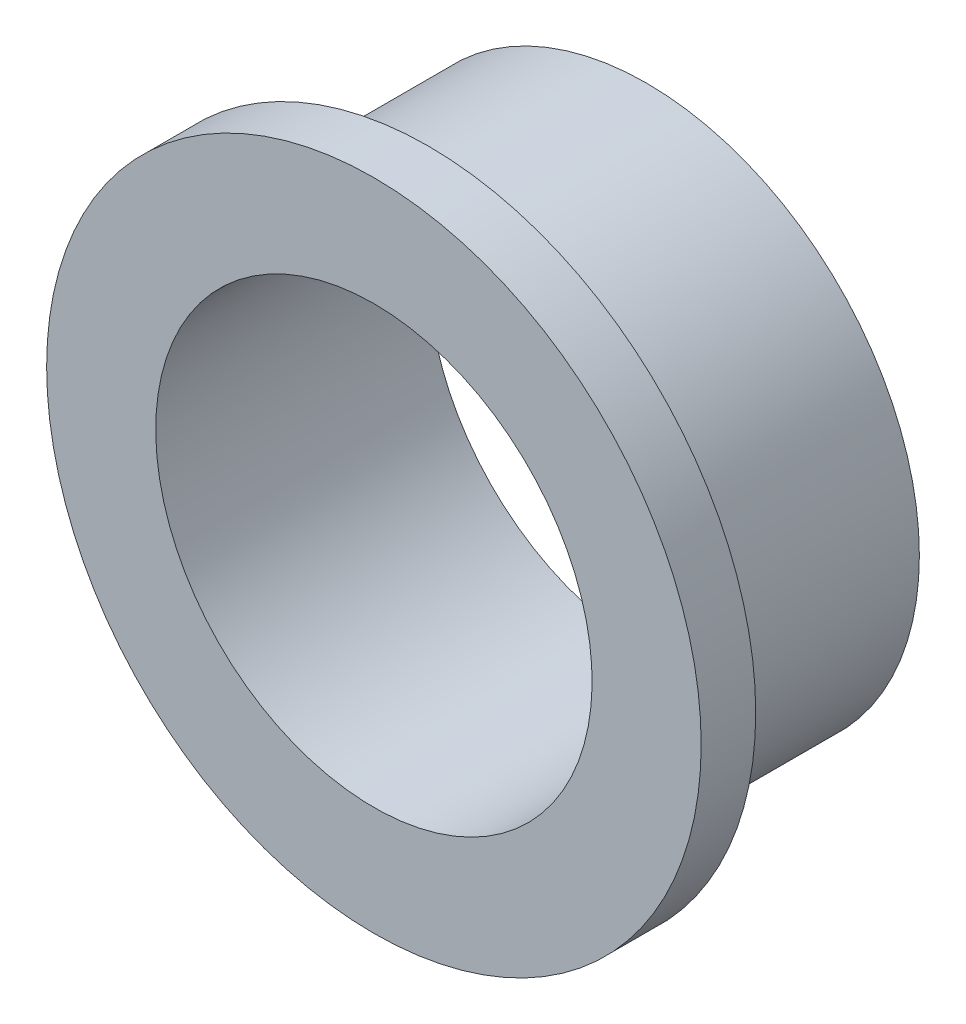
from build123d import *

# Parameters (mm, degrees)
SKETCH1_W = 12.7
SKETCH1_H = 3.175


with BuildPart() as part:
    # Sketch1 → Revolve1 (revolve)
    with BuildSketch(Plane(origin=(0, 0, 0), x_dir=(0, 0, -1), z_dir=(1, 0, 0))):
        Polygon((-12.7, 12.7), (-12.7, 6.35), (-9.525, 6.35), (-9.525, 9.525), (-9.525, 12.7), align=None)
        with Locations((-3.175, 7.9375)):
            Rectangle(SKETCH1_W, SKETCH1_H)
    revolve(axis=Axis((0, -6.35, 15.397927461), (0, 0, 1)))


solid = part.part
